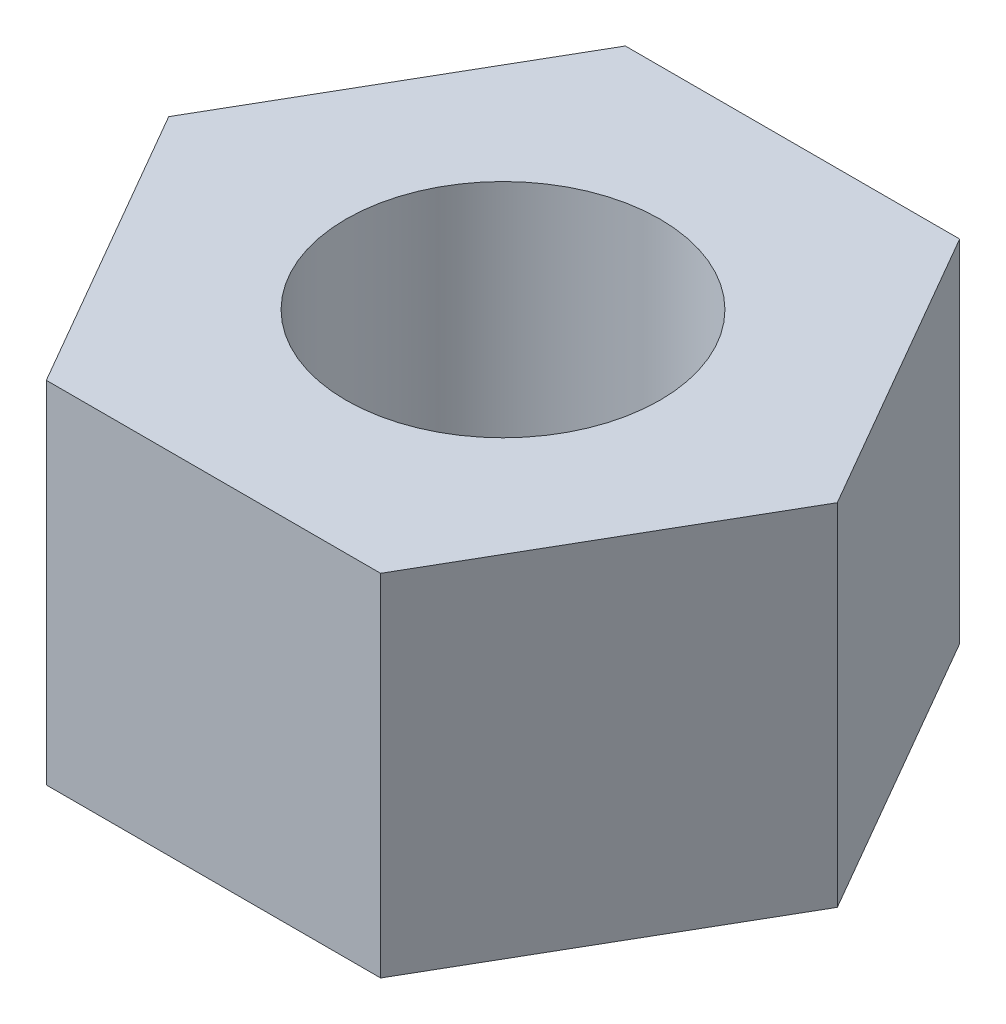
from build123d import *

# Parameters (mm, degrees)
SKETCH1_R           = 5.15
BOSS_EXTRUDE1_DEPTH = 11.5


with BuildPart() as part:
    # Sketch1 → Boss-Extrude1 (new body)
    with BuildSketch(Plane(origin=(0, 0, 0), x_dir=(1, 0, 0), z_dir=(0, 1, 0))):
        Polygon((10.969655115, 0), (5.484827557, 9.5), (-5.484827557, 9.5), (-10.969655115, 0), (-5.484827557, -9.5), (5.484827557, -9.5), align=None)
        with Locations(Location((0, 0, 0), (0, 0, 270))):
            Circle(SKETCH1_R, mode=Mode.SUBTRACT)
    extrude(amount=BOSS_EXTRUDE1_DEPTH)


solid = part.part
